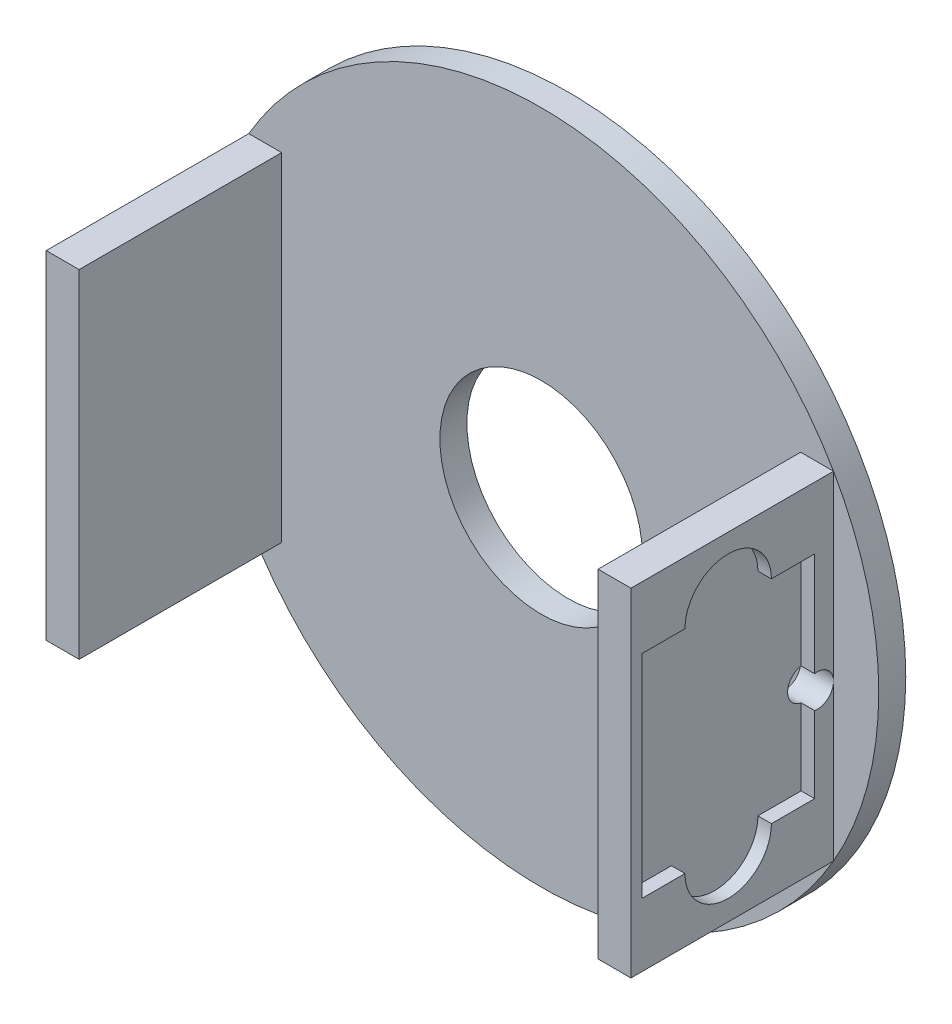
from build123d import *

# Parameters (mm, degrees)
SKETCH1_R           = 25
SKETCH1_R_2         = 7.5
BOSS_EXTRUDE1_DEPTH = 2
SKETCH3_W           = 2.436097603
SKETCH3_H           = 25
BOSS_EXTRUDE2_DEPTH = 15
SKETCH3_3_W         = 2.436097603
SKETCH3_3_H         = 25
BOSS_EXTRUDE3_DEPTH = 15
CUT_EXTRUDE3_DEPTH  = 1
SKETCH10_R          = 1.2
CUT_EXTRUDE4_DEPTH  = 9


with BuildPart() as part:
    # Sketch1 → Boss-Extrude1 (new body)
    with BuildSketch(Plane(origin=(0, 0, 0), x_dir=(0, 1, 0), z_dir=(0, 0, 1))):
        Circle(SKETCH1_R)
        Circle(SKETCH1_R_2, mode=Mode.SUBTRACT)
    extrude(amount=BOSS_EXTRUDE1_DEPTH)

    # Sketch3 → Boss-Extrude2 (add)
    with BuildSketch(Plane.XY.offset(2)):
        with Locations((-20.432586294, 0)):
            Rectangle(SKETCH3_W, SKETCH3_H)
    extrude(amount=BOSS_EXTRUDE2_DEPTH)

    # Sketch3<3> → Boss-Extrude3 (add)
    with BuildSketch(Plane.XY.offset(2)):
        with Locations((20.432586294, 0)):
            Rectangle(SKETCH3_3_W, SKETCH3_3_H)
        with Locations((-20.432586294, 0)):
            Rectangle(SKETCH3_3_W, SKETCH3_3_H)
    extrude(amount=BOSS_EXTRUDE3_DEPTH)

    # Sketch9 → Cut-Extrude3 (cut)
    with BuildSketch(Plane.YZ.offset(21.650635095)):
        with BuildLine():
            Line((-7.8, 16.2), (7.9, 16.2))
            Line((7.9, 16.2), (7.9, 13))
            ThreePointArc((7.9, 13), (11.1, 9.8), (7.9, 6.6))
            Line((7.9, 6.6), (7.9, 3.4))
            Line((7.9, 3.4), (-7.8, 3.4))
            Line((-7.8, 3.4), (-7.8, 6.6))
            ThreePointArc((-7.8, 6.6), (-11, 9.8), (-7.8, 13))
            Line((-7.8, 13), (-7.8, 16.2))
        make_face()
    extrude(amount=-CUT_EXTRUDE3_DEPTH, mode=Mode.SUBTRACT)

    # Sketch10 → Cut-Extrude4 (cut)
    with BuildSketch(Plane.YZ.offset(21.650635095)):
        with Locations((-0.968507973, 3.2)):
            Circle(SKETCH10_R)
    extrude(amount=-CUT_EXTRUDE4_DEPTH, mode=Mode.SUBTRACT)


solid = part.part
